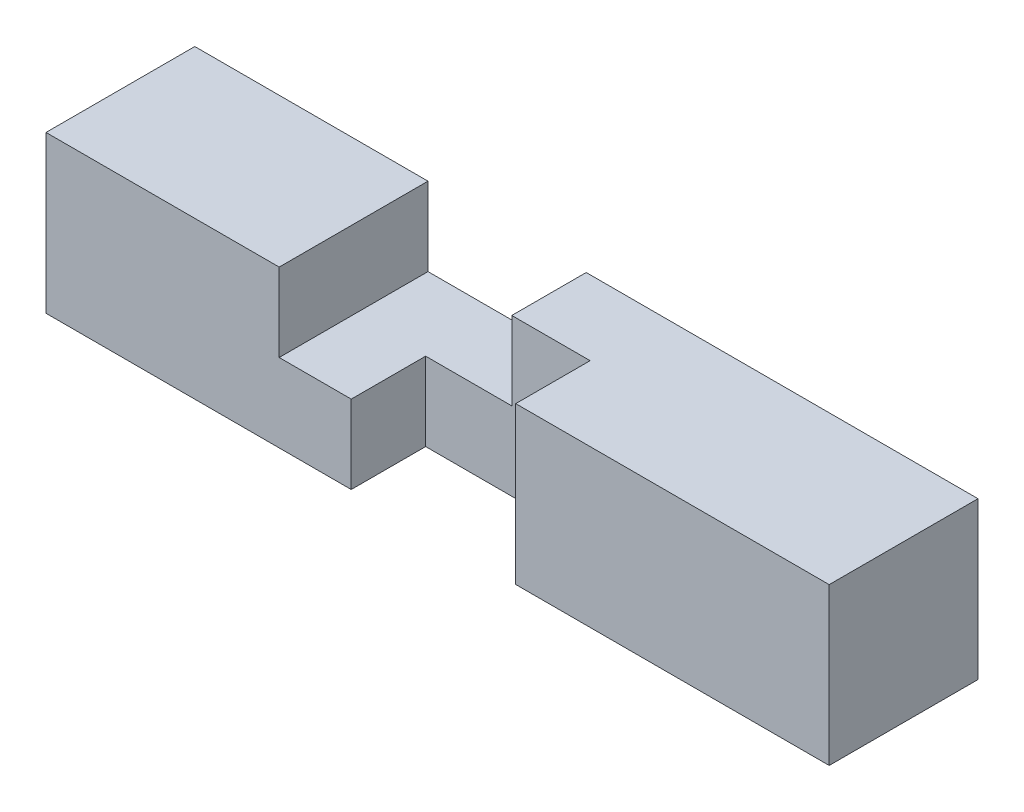
from build123d import *

# Parameters (mm, degrees)
SKETCH_1_W           = 100
SKETCH_1_H           = 20
EXTRUDE_1_DEPTH      = 19
SKETCH_2_W           = 30
SKETCH_2_H           = 9
CUT_EXTRUDE_8_DEPTH  = 36.5
SKETCH_7_W           = 11
SKETCH_7_H           = 19
CUT_EXTRUDE_9_DEPTH  = 10
SKETCH_8_W           = 20
SKETCH_8_H           = 10
CUT_EXTRUDE_10_DEPTH = 10
SKETCH_9_W           = 11
SKETCH_9_H           = 19
EXTRUDE_3_DEPTH      = 10
SKETCH_10_W          = 10
SKETCH_10_H          = 10
EXTRUDE_4_DEPTH      = 10
SKETCH_11_W          = 10
SKETCH_11_H          = 10
CUT_EXTRUDE_11_DEPTH = 10
SKETCH_16_W          = 9
SKETCH_16_H          = 20
EXTRUDE_8_DEPTH      = 10
SKETCH_17_W          = 10
SKETCH_17_H          = 10
EXTRUDE_9_DEPTH      = 20
SKETCH_12_W          = 10
SKETCH_12_H          = 9
CUT_EXTRUDE_12_DEPTH = 21
SKETCH_19_W          = 10.2
SKETCH_19_H          = 19
CUT_EXTRUDE_16_DEPTH = 10
SKETCH_20_W          = 9
SKETCH_20_H          = 20
EXTRUDE_10_DEPTH     = 10
SKETCH_21_W          = 11
SKETCH_21_H          = 10.5
CUT_EXTRUDE_17_DEPTH = 10
SKETCH_22_W          = 0.5
SKETCH_22_H          = 20
CUT_EXTRUDE_18_DEPTH = 10
SHELL_1_T            = -2
SKETCH_23_W          = 15
SKETCH_23_H          = 16
EXTRUDE_11_DEPTH     = 2


with BuildPart() as part:
    # 草圖1 → 填料-伸長1 (new body)
    with BuildSketch(Plane.XY):
        Rectangle(SKETCH_1_W, SKETCH_1_H)
    extrude(amount=EXTRUDE_1_DEPTH)

    # 草圖2 → 除料-伸長8 (cut)
    with BuildSketch(Plane(origin=(0, 10, 0), x_dir=(1, 0, 0), z_dir=(0, 1, 0))):
        with Locations((4.974315736, -14.5)):
            Rectangle(SKETCH_2_W, SKETCH_2_H)
    extrude(amount=-CUT_EXTRUDE_8_DEPTH, mode=Mode.SUBTRACT)

    # 草圖7 → 除料-伸長9 (cut)
    with BuildSketch(Plane(origin=(0, 10, 0), x_dir=(1, 0, 0), z_dir=(0, 1, 0))):
        with Locations((-15.525684264, -9.5)):
            Rectangle(SKETCH_7_W, SKETCH_7_H)
    extrude(amount=-CUT_EXTRUDE_9_DEPTH, mode=Mode.SUBTRACT)

    # 草圖8 → 除料-伸長10 (cut)
    with BuildSketch(Plane(origin=(0, 10, 0), x_dir=(1, 0, 0), z_dir=(0, 1, 0))):
        with Locations((-0.025684264, -5)):
            Rectangle(SKETCH_8_W, SKETCH_8_H)
    extrude(amount=-CUT_EXTRUDE_10_DEPTH, mode=Mode.SUBTRACT)

    # 草圖9 → 填料-伸長3 (add)
    with BuildSketch(Plane(origin=(0, 0, 0), x_dir=(1, 0, 0), z_dir=(0, 1, 0))):
        with Locations((-15.525684264, -9.5)):
            Rectangle(SKETCH_9_W, SKETCH_9_H)
    extrude(amount=EXTRUDE_3_DEPTH)

    # 草圖10 → 填料-伸長4 (add)
    with BuildSketch(Plane(origin=(-10.025684264, 0, 0), x_dir=(0, 0, -1), z_dir=(1, 0, 0))):
        with Locations((-15, -5)):
            Rectangle(SKETCH_10_W, SKETCH_10_H)
    extrude(amount=EXTRUDE_4_DEPTH)

    # 草圖11 → 除料-伸長11 (cut)
    with BuildSketch(Plane(origin=(0, 10, 0), x_dir=(1, 0, 0), z_dir=(0, 1, 0))):
        with Locations((14.974315736, -5)):
            Rectangle(SKETCH_11_W, SKETCH_11_H)
    extrude(amount=-CUT_EXTRUDE_11_DEPTH, mode=Mode.SUBTRACT)

    # 草圖16 → 填料-伸長8 (add)
    with BuildSketch(Plane.ZY.offset(-19.974315736)):
        with Locations((14.5, 0)):
            Rectangle(SKETCH_16_W, SKETCH_16_H)
    extrude(amount=EXTRUDE_8_DEPTH)

    # 草圖17 → 填料-伸長9 (add)
    with BuildSketch(Plane.ZY.offset(-19.974315736)):
        with Locations((5, 5)):
            Rectangle(SKETCH_17_W, SKETCH_17_H)
    extrude(amount=EXTRUDE_9_DEPTH)

    # 草圖12 → 除料-伸長12 (cut)
    with BuildSketch(Plane(origin=(0, 10, 0), x_dir=(1, 0, 0), z_dir=(0, 1, 0))):
        with Locations((24.974315736, -14.5)):
            Rectangle(SKETCH_12_W, SKETCH_12_H)
    extrude(amount=-CUT_EXTRUDE_12_DEPTH, mode=Mode.SUBTRACT)

    # 草圖19 → 除料-伸長16 (cut)
    with BuildSketch(Plane(origin=(0, 10, 0), x_dir=(1, 0, 0), z_dir=(0, 1, 0))):
        with Locations((-15.125684264, -9.5)):
            Rectangle(SKETCH_19_W, SKETCH_19_H)
    extrude(amount=-CUT_EXTRUDE_16_DEPTH, mode=Mode.SUBTRACT)

    # 草圖20 → 填料-伸長10 (add)
    with BuildSketch(Plane.ZY.offset(-29.974315736)):
        with Locations((14.5, 0)):
            Rectangle(SKETCH_20_W, SKETCH_20_H)
    extrude(amount=EXTRUDE_10_DEPTH)

    # 草圖21 → 除料-伸長17 (cut)
    with BuildSketch(Plane(origin=(0, 0, 0), x_dir=(1, 0, 0), z_dir=(0, 1, 0))):
        with Locations((-5.525684264, -14.75)):
            Rectangle(SKETCH_21_W, SKETCH_21_H)
    extrude(amount=-CUT_EXTRUDE_17_DEPTH, mode=Mode.SUBTRACT)

    # 草圖22 → 除料-伸長18 (cut)
    with BuildSketch(Plane.ZY.offset(0.025684264)):
        with Locations((9.75, 0)):
            Rectangle(SKETCH_22_W, SKETCH_22_H)
    extrude(amount=-CUT_EXTRUDE_18_DEPTH, mode=Mode.SUBTRACT)

    # 薄殼1
    shell_1_openings = [part.faces().sort_by_distance(p)[0] for p in [
        (50, 0, 9.5),
    ]]
    offset(amount=SHELL_1_T, openings=shell_1_openings, kind=Kind.INTERSECTION)

    # 草圖23 → 填料-伸長11 (add)
    with BuildSketch(Plane(origin=(50, 0, 0), x_dir=(0, 0, -1), z_dir=(1, 0, 0))):
        with Locations((-9.5, 0)):
            Rectangle(SKETCH_23_W, SKETCH_23_H)
    extrude(amount=-EXTRUDE_11_DEPTH)


solid = part.part
